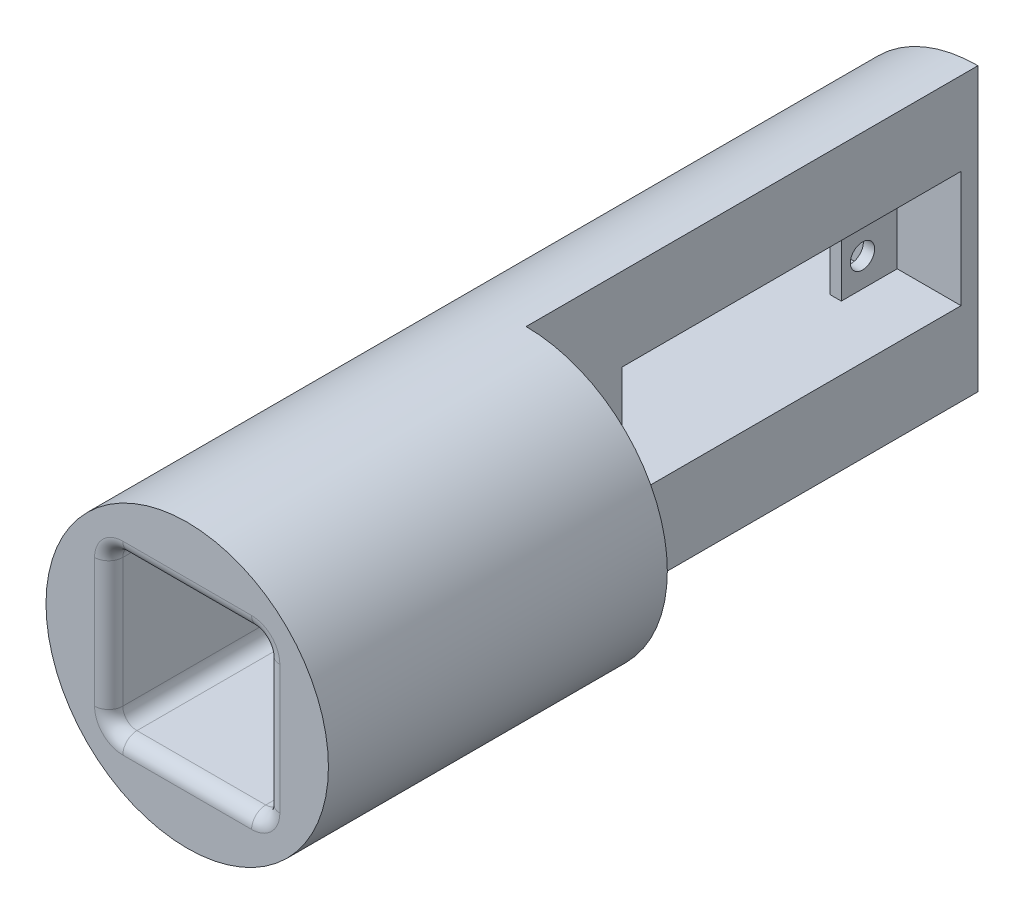
from build123d import *

# Parameters (mm, degrees)
SKETCH1_R           = 25
SKETCH1_W           = 27.8
SKETCH1_H           = 27.8
BOSS_EXTRUDE1_DEPTH = 55
BOSS_EXTRUDE2_START = 5
SKETCH2_R           = 25
SKETCH2_W           = 27.8
SKETCH2_H           = 27.8
BOSS_EXTRUDE2_DEPTH = 5
SKETCH3_W           = 25
SKETCH3_H           = 50
BOSS_EXTRUDE3_DEPTH = 80
FILLET1_R           = 2.5
FILLET2_R           = 2.5
SKETCH21_W          = 60
SKETCH21_H          = 20.6
CUT_EXTRUDE1_DEPTH  = 11.3
SKETCH22_W          = 40.5
SKETCH22_H          = 20.6
CUT_EXTRUDE2_DEPTH  = 93.059763198
CUT_EXTRUDE3_DEPTH  = 88.464278423
SKETCH23_R          = 2.15
CUT_EXTRUDE4_DEPTH  = 93.059763198
CUT_EXTRUDE7_DEPTH  = 27.5
CUT_EXTRUDE8_DEPTH  = 10


with BuildPart() as part:
    # Sketch1 → Boss-Extrude1 (new body)
    with BuildSketch(Plane.XY):
        Circle(SKETCH1_R)
        Rectangle(SKETCH1_W, SKETCH1_H, mode=Mode.SUBTRACT)
    extrude(amount=BOSS_EXTRUDE1_DEPTH)

    # Sketch2 → Boss-Extrude2 (add)
    # profile 1 of 2: a face of its own
    with BuildSketch(Plane(origin=(0, 0, 0), x_dir=(-1, 0, 0), z_dir=(0, 0, -1)).offset(BOSS_EXTRUDE2_START)):
        Circle(SKETCH2_R)
        Rectangle(SKETCH2_W, SKETCH2_H, mode=Mode.SUBTRACT)
    # profile 2 of 2: a face of its own
    with BuildSketch(Plane(origin=(0, 0, 0), x_dir=(-1, 0, 0), z_dir=(0, 0, -1)).offset(BOSS_EXTRUDE2_START)):
        Rectangle(SKETCH2_W, SKETCH2_H)
    extrude(amount=-BOSS_EXTRUDE2_DEPTH)

    # Sketch3 → Boss-Extrude3 (add)
    with BuildSketch(Plane(origin=(0, 0, -5), x_dir=(-1, 0, 0), z_dir=(0, 0, -1))):
        with Locations((12.5, 0)):
            Rectangle(SKETCH3_W, SKETCH3_H)
    extrude(amount=BOSS_EXTRUDE3_DEPTH)

    # Fillet1
    fillet1_edges = [part.edges().sort_by_distance(p)[0] for p in [
        (-13.9, 13.9, 27.5),
        (-13.9, -13.9, 27.5),
        (13.9, -13.9, 27.5),
        (13.9, 13.9, 27.5),
    ]]
    fillet(fillet1_edges, radius=FILLET1_R)

    # Fillet2
    fillet2_edges = [part.edges().sort_by_distance(p)[0] for p in [
        (0, 13.9, 55),
        (-13.9, 0, 55),
        (0, -13.9, 55),
        (13.9, 0, 55),
        (-13.167766953, 13.167766953, 55),
        (-13.167766953, -13.167766953, 55),
        (13.167766953, -13.167766953, 55),
        (13.167766953, 13.167766953, 55),
    ]]
    fillet(fillet2_edges, radius=FILLET2_R)

    # Sketch21 → Cut-Extrude1 (cut)
    with BuildSketch(Plane(origin=(0, 0, 0), x_dir=(0, 0, -1), z_dir=(1, 0, 0))):
        with Locations((52, 0)):
            Rectangle(SKETCH21_W, SKETCH21_H)
    extrude(amount=-CUT_EXTRUDE1_DEPTH, mode=Mode.SUBTRACT)

    # Sketch22 → Cut-Extrude2 (cut, through all)
    with BuildSketch(Plane(origin=(0, 0, 0), x_dir=(0, 0, -1), z_dir=(1, 0, 0))):
        with Locations((51.85, 0)):
            Rectangle(SKETCH22_W, SKETCH22_H)
    extrude(amount=-CUT_EXTRUDE2_DEPTH, mode=Mode.SUBTRACT)

    # Sketch18 → Cut-Extrude3 (cut, through all)
    with BuildSketch(Plane.XY.offset(-5)):
        with BuildLine():
            Line((-25, -25), (0, -25))
            ThreePointArc((0, -25), (-17.67766953, -17.67766953), (-25, 0))
            Line((-25, 0), (-25, -25))
        make_face()
        with BuildLine():
            Line((-25, 25), (-25, 0))
            ThreePointArc((-25, 0), (-17.67766953, 17.67766953), (0, 25))
            Line((0, 25), (-25, 25))
        make_face()
    extrude(amount=-CUT_EXTRUDE3_DEPTH, mode=Mode.SUBTRACT)

    # Sketch23 → Cut-Extrude4 (cut, through all)
    with BuildSketch(Plane(origin=(0, 0, 0), x_dir=(0, 0, -1), z_dir=(1, 0, 0))):
        with Locations(Location((27.85, -5.25, 0), (0, 0, 90))):
            Circle(SKETCH23_R)
        with Locations(Location((75.85, 5.25, 0), (0, 0, 90))):
            Circle(SKETCH23_R)
        with Locations(Location((75.85, -5.25, 0), (0, 0, 90))):
            Circle(SKETCH23_R)
        with Locations(Location((27.85, 5.25, 0), (0, 0, 90))):
            Circle(SKETCH23_R)
    extrude(amount=-CUT_EXTRUDE4_DEPTH, mode=Mode.SUBTRACT)

    # Sketch24 → Cut-Extrude7 (cut, symmetric)
    with BuildSketch(Plane(origin=(0, 0, -51.85), x_dir=(-1, 0, 0), z_dir=(0, 0, -1))):
        with BuildLine():
            Line((22.779596133, 10.3), (13.3, 10.3))
            Line((13.3, 10.3), (13.3, -10.3))
            Line((13.3, -10.3), (22.779596133, -10.3))
            ThreePointArc((22.779596133, -10.3), (25, 0), (22.779596133, 10.3))
        make_face()
    extrude(amount=CUT_EXTRUDE7_DEPTH, both=True, mode=Mode.SUBTRACT)

    # Sketch25 → Cut-Extrude8 (cut)
    with BuildSketch(Plane(origin=(0, 0, -24.35), x_dir=(-1, 0, 0), z_dir=(0, 0, -1))):
        with BuildLine():
            Line((13.3, -10.3), (22.779596133, -10.3))
            ThreePointArc((22.779596133, -10.3), (25, 0), (22.779596133, 10.3))
            Line((22.779596133, 10.3), (13.3, 10.3))
            Line((13.3, 10.3), (13.3, -10.3))
        make_face()
    extrude(amount=-CUT_EXTRUDE8_DEPTH, mode=Mode.SUBTRACT)


solid = part.part
